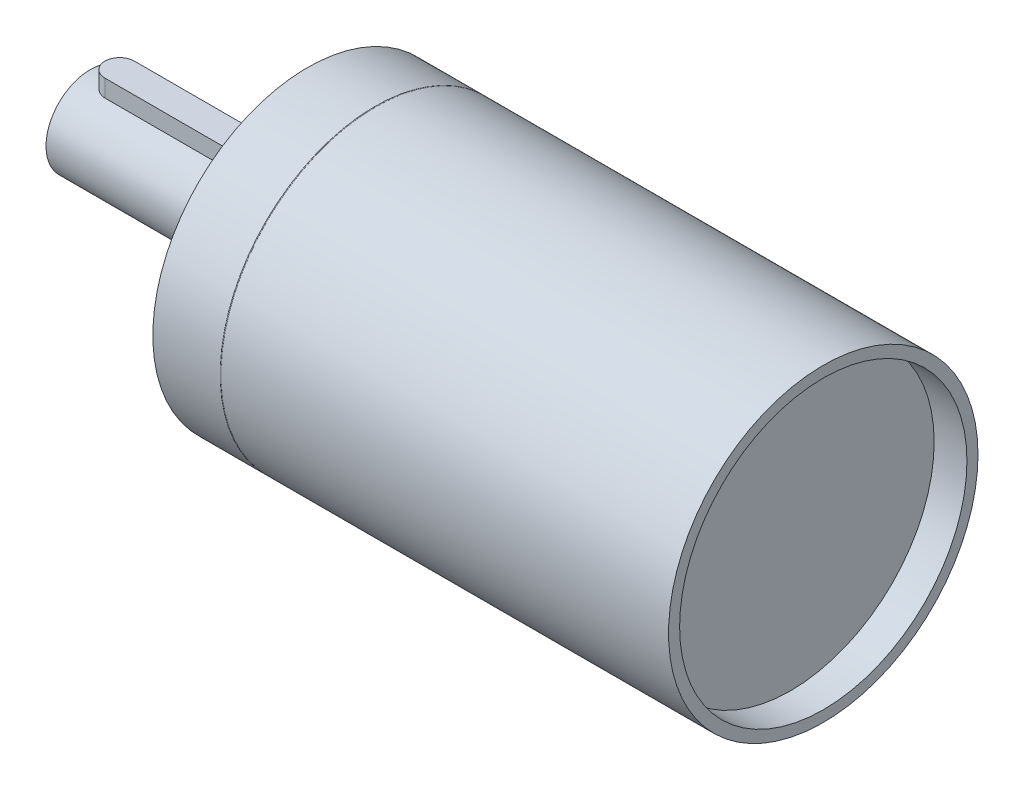
from build123d import *

# Parameters (mm, degrees)
SKETCH2_R                = 14
BOSS_EXTRUDE1_DEPTH      = 3
SKETCH3_R                = 6
BOSS_EXTRUDE2_DEPTH      = 26.5
BOSS_EXTRUDE3_DEPTH      = 1
BOSS_EXTRUDE4_REACH      = 80.626
BOSS_EXTRUDE4_END_RADIUS = 6
HOLE1_D                  = 39
HOLE1_DEPTH              = 4.45
HOLE2_D                  = 3.3
HOLE2_DEPTH              = 6
HOLE2_TIP                = 0.991420021
HOLE3_D                  = 3.3
HOLE3_DEPTH              = 6
HOLE3_TIP                = 0.991420021
HOLE4_D                  = 3.3
HOLE4_DEPTH              = 6
HOLE4_TIP                = 0.991420021
HOLE5_D                  = 3.3
HOLE5_DEPTH              = 6
HOLE5_TIP                = 0.991420021
HOLE6_D                  = 1.25
HOLE6_DEPTH              = 1.939156082
HOLE6_CSINK_D            = 2.65
HOLE6_CSINK_ANGLE        = 60
HOLE6_TIP                = 0.360843918


with BuildPart() as part:
    # Sketch1 → Revolve1 (revolve)
    with BuildSketch(Plane.XY, mode=Mode.PRIVATE) as revolve1_sk:
        with BuildLine():
            Line((0, 21), (0, 0))
            Line((0, 0), (70, 0))
            Line((70, 0), (70, 21))
            Line((70, 21), (9.25, 21))
            ThreePointArc((9.25, 21), (9.2, 20.98660254), (9.15, 21))
            Line((9.15, 21), (0, 21))
        make_face()
    revolve(revolve1_sk.sketch.rotate(Axis((0, 0, 0), (1, 0, 0)), 270), axis=Axis((0, 0, 0), (1, 0, 0)))

    # Sketch2 → Boss-Extrude1 (add)
    with BuildSketch(Plane.ZY):
        Circle(SKETCH2_R)
    extrude(amount=BOSS_EXTRUDE1_DEPTH)

    # Sketch3 → Boss-Extrude2 (add)
    with BuildSketch(Plane.ZY.offset(3)):
        Circle(SKETCH3_R)
    extrude(amount=BOSS_EXTRUDE2_DEPTH)

    # Sketch4 → Boss-Extrude3 (add)
    with BuildSketch(Plane.ZY.offset(3)):
        with BuildLine():
            Line((0.293916284, -7.616838781), (0.293916284, -5.992796778))
            ThreePointArc((0.293916284, -5.992796778), (0, 6), (-0.293916284, -5.992796778))
            Line((-0.293916284, -5.992796778), (-0.293916284, -7.616838781))
            ThreePointArc((-0.293916284, -7.616838781), (-1.755912185, -7.072113956), (-2.882513969, -5.992796778))
            ThreePointArc((-2.882513969, -5.992796778), (0, 6.65), (2.882513969, -5.992796778))
            ThreePointArc((2.882513969, -5.992796778), (1.821852016, -7.17721696), (0.293916284, -7.616838781))
        make_face()
    extrude(amount=BOSS_EXTRUDE3_DEPTH)

    # Boss-Extrude4: up to this cylinder (the profile starts outside it)
    boss_extrude4_end = Plane(origin=(-17.5, 0, 0), z_dir=(1, 0, 0)) * Cylinder(BOSS_EXTRUDE4_END_RADIUS, 174.252, mode=Mode.PRIVATE)
    # Sketch5 → Boss-Extrude4 (add, up to the surface)
    with BuildSketch(Plane(origin=(0, 8, 0), x_dir=(-1, 0, 0), z_dir=(0, 1, 0)), mode=Mode.PRIVATE) as boss_extrude4_sk1:
        with BuildLine():
            Line((9.5, -2), (25.5, -2))
            ThreePointArc((25.5, -2), (27.5, 0), (25.5, 2))
            Line((25.5, 2), (9.5, 2))
            ThreePointArc((9.5, 2), (7.5, 0), (9.5, -2))
        make_face()
    boss_extrude4_tool1 = extrude(boss_extrude4_sk1.sketch, amount=-BOSS_EXTRUDE4_REACH, mode=Mode.PRIVATE) - boss_extrude4_end
    add(boss_extrude4_tool1.solids().sort_by_distance((-17.5, 8, 0))[0])

    # Hole1
    with Locations(Plane(origin=(70, 0, 0), x_dir=(0, 0, -1), z_dir=(1, 0, 0))):
        with Locations((0, 0)):
            Hole(HOLE1_D / 2, depth=HOLE1_DEPTH)

    # Hole2
    with Locations(Plane.ZY):
        with Locations((-17.5, 3.0543e-05)):
            Hole(HOLE2_D / 2, depth=HOLE2_DEPTH)
            with Locations((0, 0, -(HOLE2_DEPTH + HOLE2_TIP / 2))):  # 118° drill point
                Cone(0, HOLE2_D / 2, HOLE2_TIP, mode=Mode.SUBTRACT)

    # Hole3
    with Locations(Plane.ZY):
        with Locations((-3.0543e-05, -17.5)):
            Hole(HOLE3_D / 2, depth=HOLE3_DEPTH)
            with Locations((0, 0, -(HOLE3_DEPTH + HOLE3_TIP / 2))):  # 118° drill point
                Cone(0, HOLE3_D / 2, HOLE3_TIP, mode=Mode.SUBTRACT)

    # Hole4
    with Locations(Plane.ZY):
        with Locations((17.5, -3.0543e-05)):
            Hole(HOLE4_D / 2, depth=HOLE4_DEPTH)
            with Locations((0, 0, -(HOLE4_DEPTH + HOLE4_TIP / 2))):  # 118° drill point
                Cone(0, HOLE4_D / 2, HOLE4_TIP, mode=Mode.SUBTRACT)

    # Hole5
    with Locations(Plane.ZY):
        with Locations((3.0543e-05, 17.5)):
            Hole(HOLE5_D / 2, depth=HOLE5_DEPTH)
            with Locations((0, 0, -(HOLE5_DEPTH + HOLE5_TIP / 2))):  # 118° drill point
                Cone(0, HOLE5_D / 2, HOLE5_TIP, mode=Mode.SUBTRACT)

    # Hole6
    with Locations(Plane.ZY.offset(29.5)):
        with Locations((0, 0)):
            CounterSinkHole(HOLE6_D / 2, HOLE6_CSINK_D / 2, depth=HOLE6_DEPTH, counter_sink_angle=HOLE6_CSINK_ANGLE)
            with Locations((0, 0, -(HOLE6_DEPTH + HOLE6_TIP / 2))):  # 120° drill point
                Cone(0, HOLE6_D / 2, HOLE6_TIP, mode=Mode.SUBTRACT)


solid = part.part
